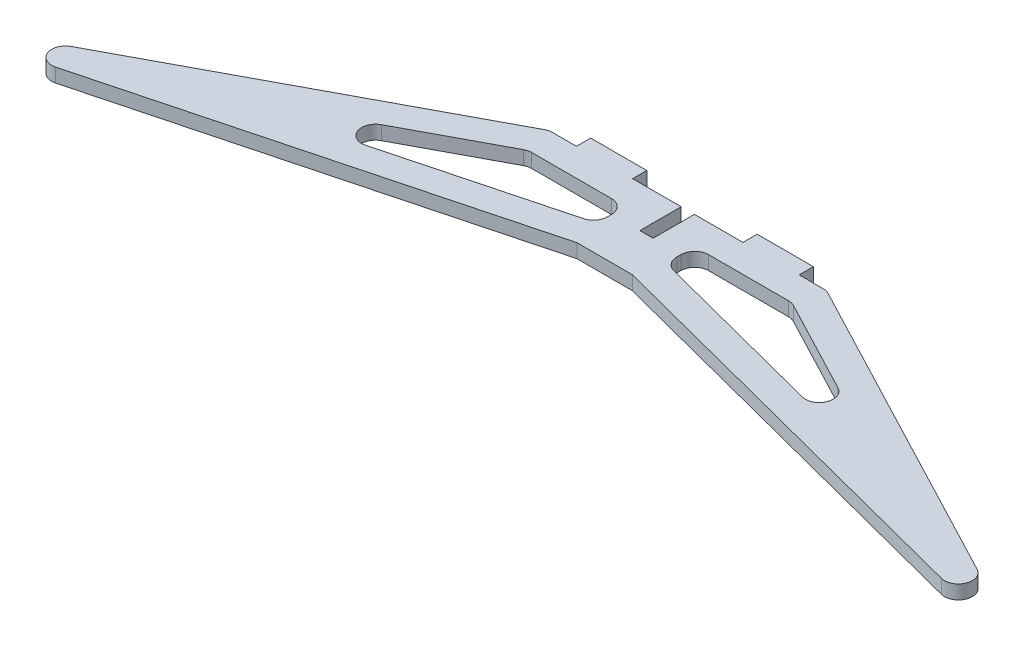
from build123d import *

# Parameters (mm, degrees)
BOSS_EXTRUDE1_DEPTH = 3.175


with BuildPart() as part:
    # Sketch2 → Boss-Extrude1 (new body)
    with BuildSketch(Plane(origin=(0, 0, 0), x_dir=(1, 0, 0), z_dir=(0, 1, 0))):
        with BuildLine():
            Line((1.5113, 0), (12.6238, 0))
            Line((12.6238, 0), (12.6238, 3.2512))
            Line((12.6238, 3.2512), (25.4762, 3.2512))
            Line((25.4762, 3.2512), (25.4762, 0))
            Line((25.4762, 0), (30.968022767, 0))
            ThreePointArc((30.968022767, 0), (31.727309935, -0.092126666), (32.442533737, -0.363160318))
            Line((32.442533737, -0.363160318), (104.164919451, -37.973926385))
            ThreePointArc((104.164919451, -37.973926385), (105.652252874, -41.929489283), (101.892440563, -43.858854449))
            Line((101.892440563, -43.858854449), (6.35, -19.05))
            Line((6.35, -19.05), (-6.35, -19.05))
            Line((-6.35, -19.05), (-100.721752751, -43.884671777))
            ThreePointArc((-100.721752751, -43.884671777), (-104.485708905, -41.973107934), (-103.023886624, -38.012739533))
            Line((-103.023886624, -38.012739533), (-32.450367647, -0.373529412))
            ThreePointArc((-32.450367647, -0.373529412), (-31.726300609, -0.094797562), (-30.95625, 0))
            Line((-30.95625, 0), (-25.4762, 0))
            Line((-25.4762, 0), (-25.4762, 3.2512))
            Line((-25.4762, 3.2512), (-12.6238, 3.2512))
            Line((-12.6238, 3.2512), (-12.6238, 0))
            Line((-12.6238, 0), (-1.5113, 0))
            Line((-1.5113, 0), (-1.5113, -9.4488))
            Line((-1.5113, -9.4488), (1.5113, -9.4488))
            Line((1.5113, -9.4488), (1.5113, 0))
        make_face()
        with BuildLine():
            Line((-52.083424577, -18.041159774), (-30.862867647, -6.723529412))
            ThreePointArc((-30.862867647, -6.723529412), (-30.138800609, -6.444797562), (-29.36875, -6.35))
            Line((-29.36875, -6.35), (-11.126341516, -6.35))
            ThreePointArc((-11.126341516, -6.35), (-8.876399737, -7.28482434), (-7.951371556, -9.538811345))
            Line((-7.951371556, -9.538811345), (-7.955433254, -10.472519677))
            ThreePointArc((-7.955433254, -10.472519677), (-8.620060106, -12.402622549), (-10.322386989, -13.529169988))
            Line((-10.322386989, -13.529169988), (-49.781290705, -23.913092018))
            ThreePointArc((-49.781290705, -23.913092018), (-53.545246858, -22.001528175), (-52.083424577, -18.041159774))
        make_face(mode=Mode.SUBTRACT)
        with BuildLine():
            Line((7.941592001, -9.529086738), (7.942778948, -10.451228904))
            ThreePointArc((7.942778948, -10.451228904), (8.607635671, -12.39131781), (10.3198084, -13.520230548))
            Line((10.3198084, -13.520230548), (50.025691322, -23.830386583))
            ThreePointArc((50.025691322, -23.830386583), (53.785503632, -21.901021417), (52.29817021, -17.945458519))
            Line((52.29817021, -17.945458519), (30.878579271, -6.713160318))
            ThreePointArc((30.878579271, -6.713160318), (30.163355469, -6.442126666), (29.404068301, -6.35))
            Line((29.404068301, -6.35), (11.116589371, -6.35))
            ThreePointArc((11.116589371, -6.35), (8.870080926, -7.281381315), (7.941592001, -9.529086738))
        make_face(mode=Mode.SUBTRACT)
    extrude(amount=BOSS_EXTRUDE1_DEPTH)


solid = part.part
